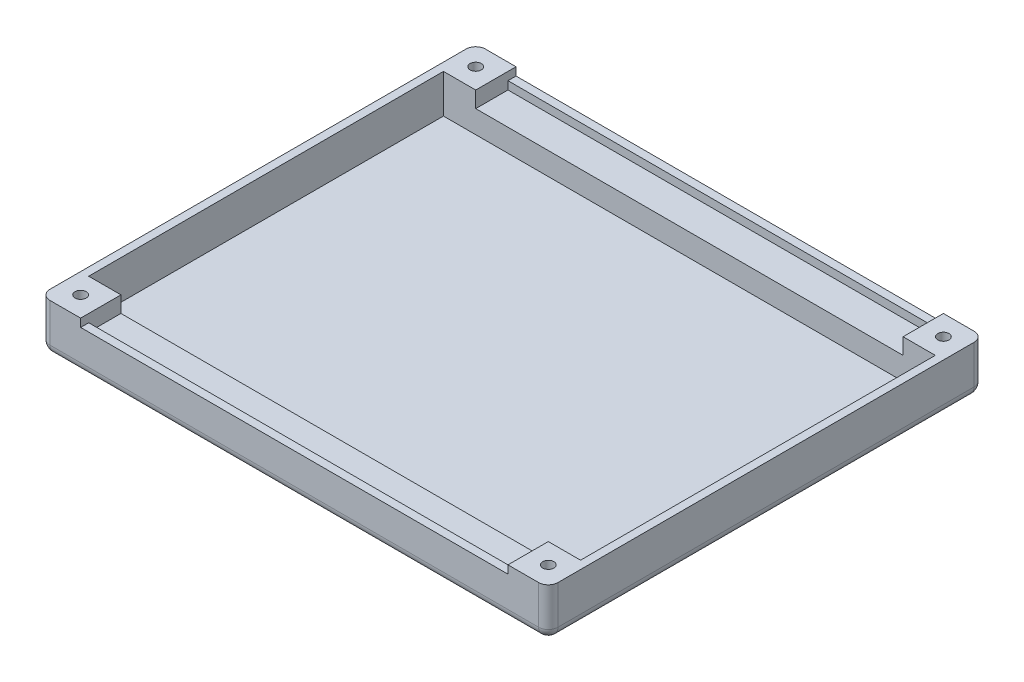
from build123d import *

# Parameters (mm, degrees)
SKETCH1_W           = 200.025
SKETCH1_H           = 171.45
BOSS_EXTRUDE1_DEPTH = 19.05
SKETCH2_W           = 193.675
SKETCH2_H           = 139.7
CUT_EXTRUDE1_DEPTH  = 15.24
SKETCH4_W           = 168.275
SKETCH4_H           = 171.45
CUT_EXTRUDE2_DEPTH  = 3.175
SKETCH5_W           = 168.275
SKETCH5_H           = 12.7
CUT_EXTRUDE3_DEPTH  = 3.175
SKETCH7_W           = 168.275
SKETCH7_H           = 12.7
CUT_EXTRUDE5_DEPTH  = 3.175
SKETCH11_R          = 2.2
CUT_EXTRUDE6_DEPTH  = 33.5
FILLET3_R           = 3.81


with BuildPart() as part:
    # Sketch1 → Boss-Extrude1 (new body)
    with BuildSketch(Plane(origin=(0, 0, 0), x_dir=(1, 0, 0), z_dir=(0, 1, 0))):
        Rectangle(SKETCH1_W, SKETCH1_H)
    extrude(amount=BOSS_EXTRUDE1_DEPTH)

    # Sketch2 → Cut-Extrude1 (cut)
    with BuildSketch(Plane(origin=(0, 19.05, 0), x_dir=(1, 0, 0), z_dir=(0, 1, 0))):
        Rectangle(SKETCH2_W, SKETCH2_H)
    extrude(amount=-CUT_EXTRUDE1_DEPTH, mode=Mode.SUBTRACT)

    # Sketch4 → Cut-Extrude2 (cut)
    with BuildSketch(Plane(origin=(0, 19.05, 0), x_dir=(1, 0, 0), z_dir=(0, 1, 0))):
        Rectangle(SKETCH4_W, SKETCH4_H)
    extrude(amount=-CUT_EXTRUDE2_DEPTH, mode=Mode.SUBTRACT)

    # Sketch5 → Cut-Extrude3 (cut)
    with BuildSketch(Plane(origin=(0, 15.875, 0), x_dir=(1, 0, 0), z_dir=(0, 1, 0))):
        with Locations((0, -76.2)):
            Rectangle(SKETCH5_W, SKETCH5_H)
    extrude(amount=-CUT_EXTRUDE3_DEPTH, mode=Mode.SUBTRACT)

    # Sketch7 → Cut-Extrude5 (cut)
    with BuildSketch(Plane(origin=(0, 15.875, 0), x_dir=(1, 0, 0), z_dir=(0, 1, 0))):
        with Locations((0, 76.2)):
            Rectangle(SKETCH7_W, SKETCH7_H)
    extrude(amount=-CUT_EXTRUDE5_DEPTH, mode=Mode.SUBTRACT)

    # Sketch11 → Cut-Extrude6 (cut)
    with BuildSketch(Plane(origin=(0, 19.05, 0), x_dir=(1, 0, 0), z_dir=(0, 1, 0))):
        with Locations(Location((92.075, 77.7875, 0), (0, 0, 270))):
            Circle(SKETCH11_R)
        with Locations(Location((92.075, -77.7875, 0), (0, 0, 90))):
            Circle(SKETCH11_R)
    cut_extrude6 = extrude(amount=-CUT_EXTRUDE6_DEPTH, mode=Mode.SUBTRACT)

    # Fillet3
    fillet3_edges = [part.edges().sort_by_distance(p)[0] for p in [
        (0, 0, 85.725),
        (-100.0125, 0, 0),
        (0, 0, -85.725),
        (100.0125, 0, 0),
        (100.0125, 9.525, 85.725),
        (-100.0125, 9.525, 85.725),
        (-100.0125, 9.525, -85.725),
        (100.0125, 9.525, -85.725),
    ]]
    fillet(fillet3_edges, radius=FILLET3_R)

    # Mirror1: Cut-Extrude6 across plane
    add(cut_extrude6.mirror(Plane(origin=(0, 0, 0), x_dir=(0, 0, 1), z_dir=(1, 0, 0))), mode=Mode.SUBTRACT)


solid = part.part
